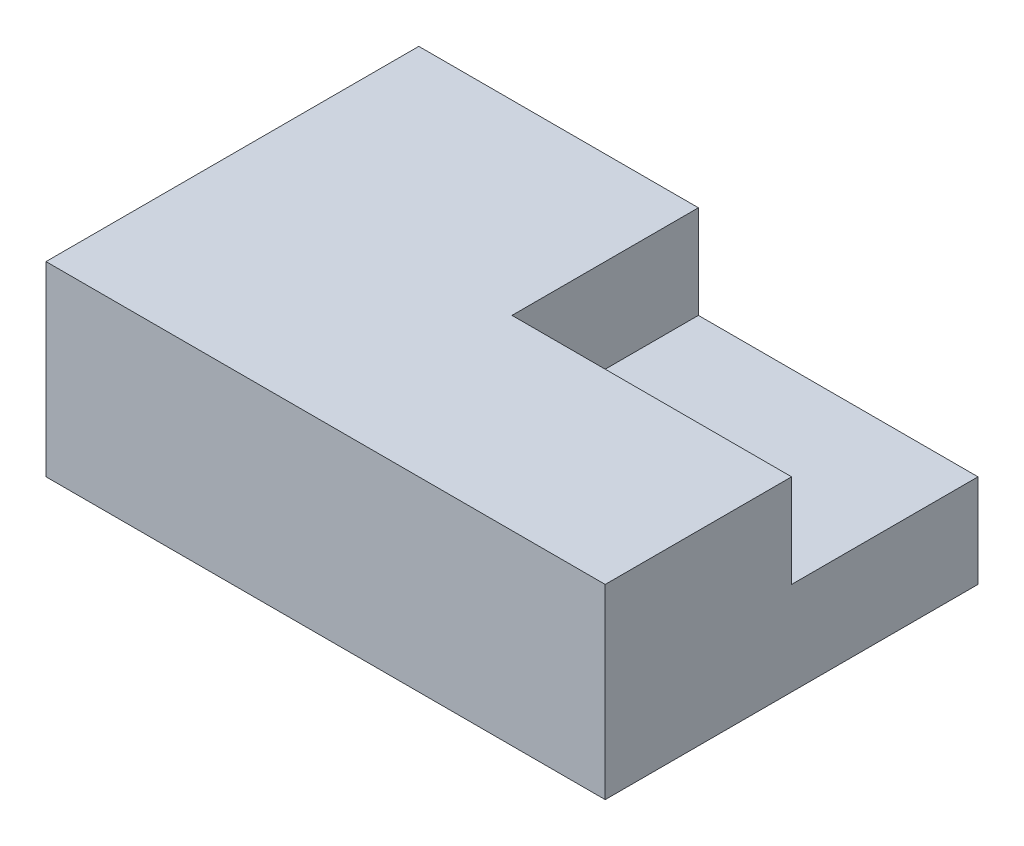
from build123d import *

# Parameters (mm, degrees)
SKETCH_1_W          = 30
SKETCH_1_H          = 20
EXTRUDE_1_DEPTH     = 5
SKETCH_2_W          = 15
SKETCH_2_H          = 10
CUT_EXTRUDE_1_DEPTH = 19.708286934


with BuildPart() as part:
    # 草图1 → 凸台-拉伸1 (new, symmetric)
    with BuildSketch(Plane(origin=(0, 0, 0), x_dir=(1, 0, 0), z_dir=(0, 1, 0))):
        Rectangle(SKETCH_1_W, SKETCH_1_H)
    extrude(amount=EXTRUDE_1_DEPTH, both=True)

    # 草图2 → 切除-拉伸1 (cut, through all)
    with BuildSketch(Plane(origin=(0, 0, 0), x_dir=(1, 0, 0), z_dir=(0, 1, 0))):
        with Locations((7.5, 5)):
            Rectangle(SKETCH_2_W, SKETCH_2_H)
    extrude(amount=CUT_EXTRUDE_1_DEPTH, mode=Mode.SUBTRACT)


solid = part.part
